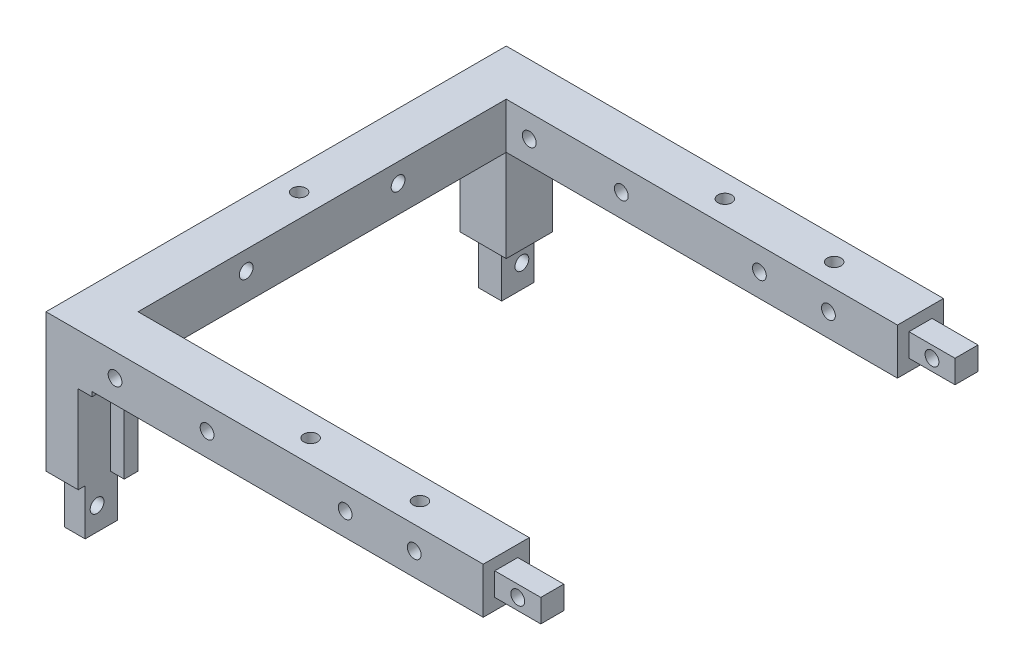
from build123d import *

# Parameters (mm, degrees)
SKETCH1_W               = 320
SKETCH1_H               = 200
SKETCH1_W_2             = 280
SKETCH1_H_2             = 160
BOSS_EXTRUDE1_DEPTH     = 20
SKETCH2_W               = 130
SKETCH2_H               = 200
CUT_EXTRUDE1_DEPTH      = 20
SKETCH5_W               = 20
SKETCH5_H               = 20
BOSS_EXTRUDE4_DEPTH     = 40
SKETCH8_W               = 10
SKETCH8_H               = 14
BOSS_EXTRUDE5_DEPTH     = 20
SKETCH9_W               = 10
SKETCH9_H               = 14
BOSS_EXTRUDE6_DEPTH     = 20
SKETCH10_W              = 10
SKETCH10_H              = 10
BOSS_EXTRUDE7_DEPTH     = 20
SKETCH11_R              = 3
CUT_EXTRUDE2_DEPTH      = 30
SKETCH13_R              = 3
CUT_EXTRUDE3_DEPTH      = 30
CUT_EXTRUDE4_DEPTH      = 297.141857899
CUT_EXTRUDE4_DEPTH_BACK = 297.141857899
SKETCH14_R              = 3
CUT_EXTRUDE5_DEPTH      = 293.788319439
CUT_EXTRUDE5_DEPTH_BACK = 293.788319439
SKETCH16_R              = 3
SKETCH19_W              = 14
SKETCH19_H              = 38
CUT_EXTRUDE8_DEPTH      = 5
CUT_EXTRUDE9_DEPTH      = 1


with BuildPart() as part:
    # Sketch1 → Boss-Extrude1 (new body)
    with BuildSketch(Plane(origin=(0, 0, 0), x_dir=(1, 0, 0), z_dir=(0, 1, 0))):
        with Locations((160, 100)):
            Rectangle(SKETCH1_W, SKETCH1_H)
        with Locations((160, 100)):
            Rectangle(SKETCH1_W_2, SKETCH1_H_2, mode=Mode.SUBTRACT)
    extrude(amount=BOSS_EXTRUDE1_DEPTH)

    # Sketch2 → Cut-Extrude1 (cut)
    with BuildSketch(Plane(origin=(0, 20, 0), x_dir=(1, 0, 0), z_dir=(0, 1, 0))):
        with Locations((255, 100)):
            Rectangle(SKETCH2_W, SKETCH2_H)
    extrude(amount=-CUT_EXTRUDE1_DEPTH, mode=Mode.SUBTRACT)

    # Sketch5 → Boss-Extrude4 (add)
    with BuildSketch(Plane.XZ):
        with Locations((10, -10)):
            Rectangle(SKETCH5_W, SKETCH5_H)
        with Locations((10, -190)):
            Rectangle(SKETCH5_W, SKETCH5_H)
    extrude(amount=BOSS_EXTRUDE4_DEPTH)

    # Sketch8 → Boss-Extrude5 (add)
    with BuildSketch(Plane.XZ.offset(40)):
        with Locations((10, -10)):
            Rectangle(SKETCH8_W, SKETCH8_H)
    extrude(amount=BOSS_EXTRUDE5_DEPTH)

    # Sketch9 → Boss-Extrude6 (add)
    with BuildSketch(Plane.XZ.offset(40)):
        with Locations((10, -190)):
            Rectangle(SKETCH9_W, SKETCH9_H)
    extrude(amount=BOSS_EXTRUDE6_DEPTH)

    # Sketch10 → Boss-Extrude7 (add)
    with BuildSketch(Plane(origin=(190, 0, 0), x_dir=(0, 0, -1), z_dir=(1, 0, 0))):
        with Locations((190, 10)):
            Rectangle(SKETCH10_W, SKETCH10_H)
        with Locations((10, 10)):
            Rectangle(SKETCH10_W, SKETCH10_H)
    extrude(amount=BOSS_EXTRUDE7_DEPTH)

    # Sketch11 → Cut-Extrude2 (cut)
    with BuildSketch(Plane(origin=(0, 20, 0), x_dir=(1, 0, 0), z_dir=(0, 1, 0))):
        with Locations(Location((152.5, 190, 0), (0, 0, 270))):
            Circle(SKETCH11_R)
        with Locations(Location((105, 190, 0), (0, 0, 270))):
            Circle(SKETCH11_R)
        with Locations(Location((10, 100, 0), (0, 0, 270))):
            Circle(SKETCH11_R)
        with Locations(Location((152.5, 10, 0), (0, 0, 90))):
            Circle(SKETCH11_R)
        with Locations(Location((105, 10, 0), (0, 0, 90))):
            Circle(SKETCH11_R)
    extrude(amount=-CUT_EXTRUDE2_DEPTH, mode=Mode.SUBTRACT)

    # Sketch13 → Cut-Extrude3 (cut)
    with BuildSketch(Plane.ZY):
        with Locations((-8.2, -50)):
            Circle(SKETCH13_R)
        with Locations((-67, 11.8)):
            Circle(SKETCH13_R)
        with Locations((-133, 11.8)):
            Circle(SKETCH13_R)
        with Locations((-191.8, -50)):
            Circle(SKETCH13_R)
    extrude(amount=-CUT_EXTRUDE3_DEPTH, mode=Mode.SUBTRACT)

    # Sketch14 → Cut-Extrude4 (cut, two sides: drawn at the far end of the back side and taken through both)
    with BuildSketch(Plane(origin=(0, 0, -200), x_dir=(-1, 0, 0), z_dir=(0, 0, -1)).offset(-CUT_EXTRUDE4_DEPTH_BACK)):
        with Locations((-160, 10)):
            Circle(SKETCH14_R)
        with Locations((-30, 10)):
            Circle(SKETCH14_R)
        with Locations((-70, 10)):
            Circle(SKETCH14_R)
        with Locations((-130, 10)):
            Circle(SKETCH14_R)
    extrude(amount=CUT_EXTRUDE4_DEPTH + CUT_EXTRUDE4_DEPTH_BACK, mode=Mode.SUBTRACT)

    # Sketch16 → Cut-Extrude5 (cut, two sides: drawn at the far end of the back side and taken through both)
    with BuildSketch(Plane.XY.offset(-5).offset(-CUT_EXTRUDE5_DEPTH_BACK)):
        with Locations((200, 10)):
            Circle(SKETCH16_R)
    extrude(amount=CUT_EXTRUDE5_DEPTH + CUT_EXTRUDE5_DEPTH_BACK, mode=Mode.SUBTRACT)

    # Sketch19 → Cut-Extrude8 (cut)
    with BuildSketch(Plane(origin=(20, 0, 0), x_dir=(0, 0, -1), z_dir=(1, 0, 0))):
        with Locations((7, -21)):
            Rectangle(SKETCH19_W, SKETCH19_H)
    extrude(amount=-CUT_EXTRUDE8_DEPTH, mode=Mode.SUBTRACT)

    # Sketch20 → Cut-Extrude9 (cut)
    with BuildSketch(Plane(origin=(15, 0, 0), x_dir=(0, 0, -1), z_dir=(1, 0, 0))):
        Polygon((0, -2), (0, -40), (3, -40), (3, -60), (17, -60), (17, -40), (14, -40), (14, -2), align=None)
    extrude(amount=-CUT_EXTRUDE9_DEPTH, mode=Mode.SUBTRACT)


solid = part.part
